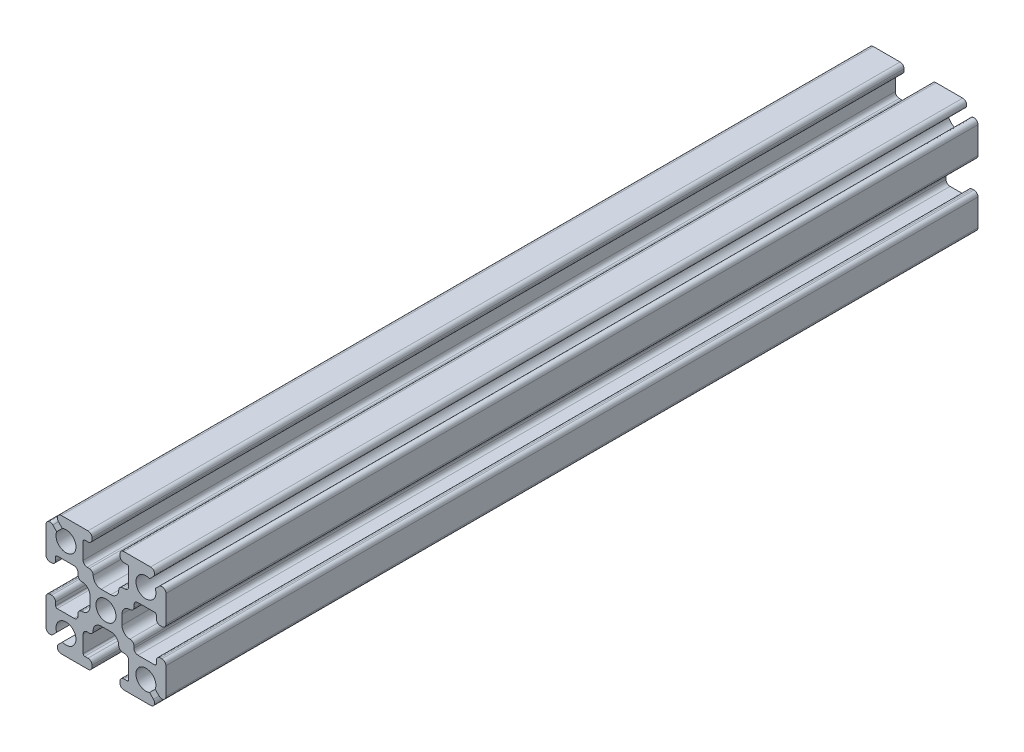
from build123d import *

# Parameters (mm, degrees)
SKETCH1_R           = 1.25
BOSS_EXTRUDE1_DEPTH = 101.6


with BuildPart() as part:
    # Sketch1 → Boss-Extrude1 (new body)
    with BuildSketch(Plane.XY):
        with BuildLine():
            Line((6.646446609, 5.939339828), (6.163645978, 5.456539197))
            ThreePointArc((6.163645978, 5.456539197), (4.116116524, 4.116116524), (5.456539197, 6.163645978))
            Line((5.456539197, 6.163645978), (5.939339828, 6.646446609))
            ThreePointArc((5.939339828, 6.646446609), (6.047726204, 7.191341716), (5.585786438, 7.5))
            Line((5.585786438, 7.5), (2.25, 7.5))
            ThreePointArc((2.25, 7.5), (1.896446609, 7.353553391), (1.75, 7))
            Line((1.75, 7), (1.75, 6.8))
            ThreePointArc((1.75, 6.8), (1.896446609, 6.446446609), (2.25, 6.3))
            Line((2.25, 6.3), (2.65, 6.3))
            ThreePointArc((2.65, 6.3), (2.791421356, 6.241421356), (2.85, 6.1))
            Line((2.85, 6.1), (2.85, 4))
            ThreePointArc((2.85, 4), (2.703553391, 3.646446609), (2.35, 3.5))
            Line((2.35, 3.5), (2.1, 3.5))
            ThreePointArc((2.1, 3.5), (1.746446609, 3.353553391), (1.6, 3))
            ThreePointArc((1.6, 3), (1.307106781, 2.292893219), (0.6, 2))
            Line((0.6, 2), (-0.6, 2))
            ThreePointArc((-0.6, 2), (-1.307106781, 2.292893219), (-1.6, 3))
            ThreePointArc((-1.6, 3), (-1.746446609, 3.353553391), (-2.1, 3.5))
            Line((-2.1, 3.5), (-2.35, 3.5))
            ThreePointArc((-2.35, 3.5), (-2.703553391, 3.646446609), (-2.85, 4))
            Line((-2.85, 4), (-2.85, 6.1))
            ThreePointArc((-2.85, 6.1), (-2.791421356, 6.241421356), (-2.65, 6.3))
            Line((-2.65, 6.3), (-2.25, 6.3))
            ThreePointArc((-2.25, 6.3), (-1.896446609, 6.446446609), (-1.75, 6.8))
            Line((-1.75, 6.8), (-1.75, 7))
            ThreePointArc((-1.75, 7), (-1.896446609, 7.353553391), (-2.25, 7.5))
            Line((-2.25, 7.5), (-5.585786438, 7.5))
            ThreePointArc((-5.585786438, 7.5), (-6.047726204, 7.191341716), (-5.939339828, 6.646446609))
            Line((-5.939339828, 6.646446609), (-5.456539197, 6.163645978))
            ThreePointArc((-5.456539197, 6.163645978), (-4.116116524, 4.116116524), (-6.163645978, 5.456539197))
            Line((-6.163645978, 5.456539197), (-6.646446609, 5.939339828))
            ThreePointArc((-6.646446609, 5.939339828), (-7.191341716, 6.047726204), (-7.5, 5.585786438))
            Line((-7.5, 5.585786438), (-7.5, 2.25))
            ThreePointArc((-7.5, 2.25), (-7.353553391, 1.896446609), (-7, 1.75))
            Line((-7, 1.75), (-6.8, 1.75))
            ThreePointArc((-6.8, 1.75), (-6.446446609, 1.896446609), (-6.3, 2.25))
            Line((-6.3, 2.25), (-6.3, 2.65))
            ThreePointArc((-6.3, 2.65), (-6.241421356, 2.791421356), (-6.1, 2.85))
            Line((-6.1, 2.85), (-4, 2.85))
            ThreePointArc((-4, 2.85), (-3.646446609, 2.703553391), (-3.5, 2.35))
            Line((-3.5, 2.35), (-3.5, 2.1))
            ThreePointArc((-3.5, 2.1), (-3.353553391, 1.746446609), (-3, 1.6))
            ThreePointArc((-3, 1.6), (-2.292893219, 1.307106781), (-2, 0.6))
            Line((-2, 0.6), (-2, -0.6))
            ThreePointArc((-2, -0.6), (-2.292893219, -1.307106781), (-3, -1.6))
            ThreePointArc((-3, -1.6), (-3.353553391, -1.746446609), (-3.5, -2.1))
            Line((-3.5, -2.1), (-3.5, -2.35))
            ThreePointArc((-3.5, -2.35), (-3.646446609, -2.703553391), (-4, -2.85))
            Line((-4, -2.85), (-6.1, -2.85))
            ThreePointArc((-6.1, -2.85), (-6.241421356, -2.791421356), (-6.3, -2.65))
            Line((-6.3, -2.65), (-6.3, -2.25))
            ThreePointArc((-6.3, -2.25), (-6.446446609, -1.896446609), (-6.8, -1.75))
            Line((-6.8, -1.75), (-7, -1.75))
            ThreePointArc((-7, -1.75), (-7.353553391, -1.896446609), (-7.5, -2.25))
            Line((-7.5, -2.25), (-7.5, -5.585786438))
            ThreePointArc((-7.5, -5.585786438), (-7.191341716, -6.047726204), (-6.646446609, -5.939339828))
            Line((-6.646446609, -5.939339828), (-6.163645978, -5.456539197))
            ThreePointArc((-6.163645978, -5.456539197), (-4.116116524, -4.116116524), (-5.456539197, -6.163645978))
            Line((-5.456539197, -6.163645978), (-5.939339828, -6.646446609))
            ThreePointArc((-5.939339828, -6.646446609), (-6.047726204, -7.191341716), (-5.585786438, -7.5))
            Line((-5.585786438, -7.5), (-2.25, -7.5))
            ThreePointArc((-2.25, -7.5), (-1.896446609, -7.353553391), (-1.75, -7))
            Line((-1.75, -7), (-1.75, -6.8))
            ThreePointArc((-1.75, -6.8), (-1.896446609, -6.446446609), (-2.25, -6.3))
            Line((-2.25, -6.3), (-2.65, -6.3))
            ThreePointArc((-2.65, -6.3), (-2.791421356, -6.241421356), (-2.85, -6.1))
            Line((-2.85, -6.1), (-2.85, -4))
            ThreePointArc((-2.85, -4), (-2.703553391, -3.646446609), (-2.35, -3.5))
            Line((-2.35, -3.5), (-2.1, -3.5))
            ThreePointArc((-2.1, -3.5), (-1.746446609, -3.353553391), (-1.6, -3))
            ThreePointArc((-1.6, -3), (-1.307106781, -2.292893219), (-0.6, -2))
            Line((-0.6, -2), (0.6, -2))
            ThreePointArc((0.6, -2), (1.307106781, -2.292893219), (1.6, -3))
            ThreePointArc((1.6, -3), (1.746446609, -3.353553391), (2.1, -3.5))
            Line((2.1, -3.5), (2.35, -3.5))
            ThreePointArc((2.35, -3.5), (2.703553391, -3.646446609), (2.85, -4))
            Line((2.85, -4), (2.85, -6.1))
            ThreePointArc((2.85, -6.1), (2.791421356, -6.241421356), (2.65, -6.3))
            Line((2.65, -6.3), (2.25, -6.3))
            ThreePointArc((2.25, -6.3), (1.896446609, -6.446446609), (1.75, -6.8))
            Line((1.75, -6.8), (1.75, -7))
            ThreePointArc((1.75, -7), (1.896446609, -7.353553391), (2.25, -7.5))
            Line((2.25, -7.5), (5.585786438, -7.5))
            ThreePointArc((5.585786438, -7.5), (6.047726204, -7.191341716), (5.939339828, -6.646446609))
            Line((5.939339828, -6.646446609), (5.456539197, -6.163645978))
            ThreePointArc((5.456539197, -6.163645978), (4.116116524, -4.116116524), (6.163645978, -5.456539197))
            Line((6.163645978, -5.456539197), (6.646446609, -5.939339828))
            ThreePointArc((6.646446609, -5.939339828), (7.191341716, -6.047726204), (7.5, -5.585786438))
            Line((7.5, -5.585786438), (7.5, -2.25))
            ThreePointArc((7.5, -2.25), (7.353553391, -1.896446609), (7, -1.75))
            Line((7, -1.75), (6.8, -1.75))
            ThreePointArc((6.8, -1.75), (6.446446609, -1.896446609), (6.3, -2.25))
            Line((6.3, -2.25), (6.3, -2.65))
            ThreePointArc((6.3, -2.65), (6.241421356, -2.791421356), (6.1, -2.85))
            Line((6.1, -2.85), (4, -2.85))
            ThreePointArc((4, -2.85), (3.646446609, -2.703553391), (3.5, -2.35))
            Line((3.5, -2.35), (3.5, -2.1))
            ThreePointArc((3.5, -2.1), (3.353553391, -1.746446609), (3, -1.6))
            ThreePointArc((3, -1.6), (2.292893219, -1.307106781), (2, -0.6))
            Line((2, -0.6), (2, 0.6))
            ThreePointArc((2, 0.6), (2.292893219, 1.307106781), (3, 1.6))
            ThreePointArc((3, 1.6), (3.353553391, 1.746446609), (3.5, 2.1))
            Line((3.5, 2.1), (3.5, 2.35))
            ThreePointArc((3.5, 2.35), (3.646446609, 2.703553391), (4, 2.85))
            Line((4, 2.85), (6.1, 2.85))
            ThreePointArc((6.1, 2.85), (6.241421356, 2.791421356), (6.3, 2.65))
            Line((6.3, 2.65), (6.3, 2.25))
            ThreePointArc((6.3, 2.25), (6.446446609, 1.896446609), (6.8, 1.75))
            Line((6.8, 1.75), (7, 1.75))
            ThreePointArc((7, 1.75), (7.353553391, 1.896446609), (7.5, 2.25))
            Line((7.5, 2.25), (7.5, 5.585786438))
            ThreePointArc((7.5, 5.585786438), (7.191341716, 6.047726204), (6.646446609, 5.939339828))
        make_face()
        with Locations(Location((0, 0, 0), (0, 0, 180))):
            Circle(SKETCH1_R, mode=Mode.SUBTRACT)
    extrude(amount=BOSS_EXTRUDE1_DEPTH)


solid = part.part
